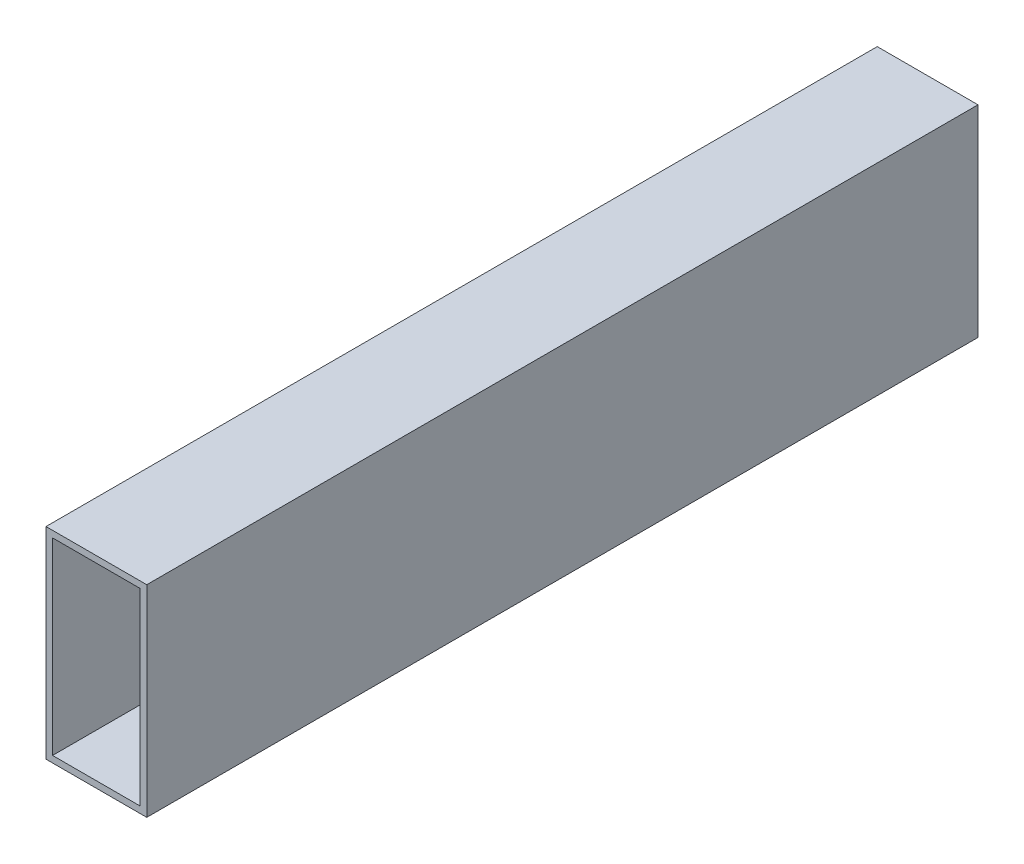
from build123d import *

# Parameters (mm, degrees)
SKETCH1_W           = 25.4
SKETCH1_H           = 50.8
SKETCH1_W_2         = 22.098
SKETCH1_H_2         = 47.498
BOSS_EXTRUDE1_DEPTH = 209.55


with BuildPart() as part:
    # Sketch1 → Boss-Extrude1 (new body)
    with BuildSketch(Plane.XY):
        with Locations((-37.799408284, -17.466199221)):
            Rectangle(SKETCH1_W, SKETCH1_H)
        with Locations((-37.799408284, -17.466199221)):
            Rectangle(SKETCH1_W_2, SKETCH1_H_2, mode=Mode.SUBTRACT)
    extrude(amount=BOSS_EXTRUDE1_DEPTH)


solid = part.part
